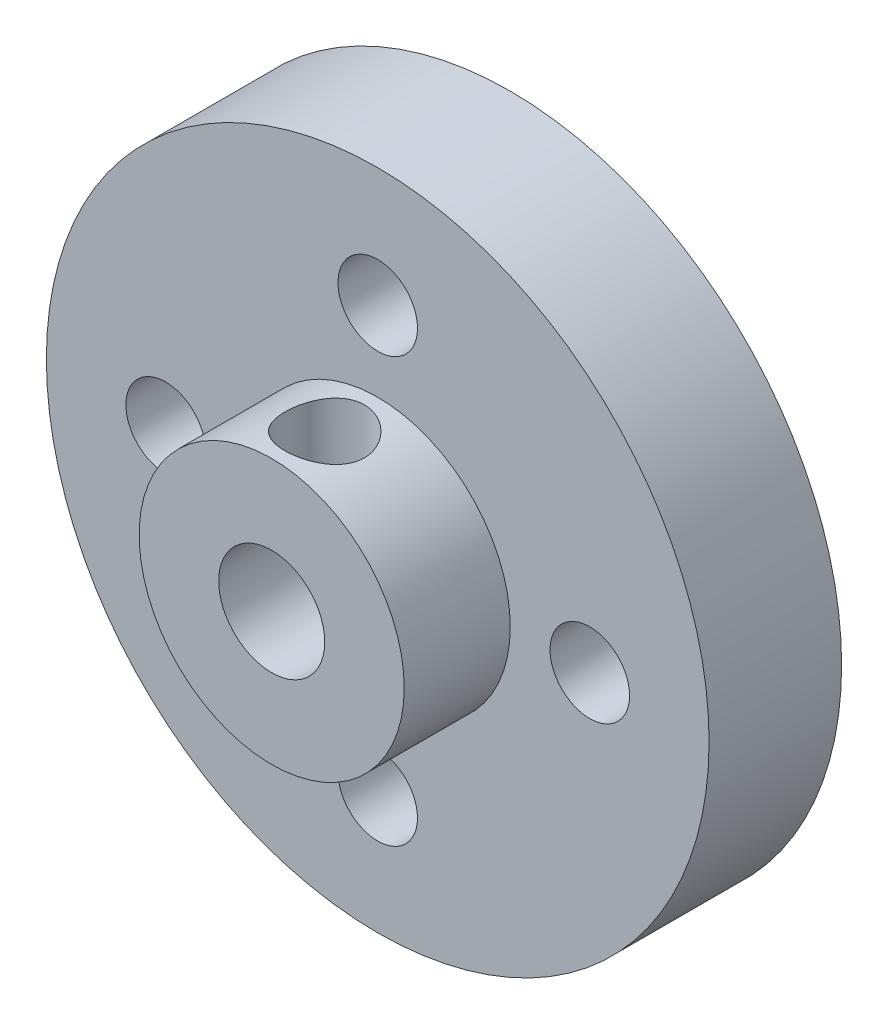
from build123d import *

# Parameters (mm, degrees)
ESQUISSE1_R             = 12.5
ESQUISSE1_R_2           = 5
ESQUISSE1_R_3           = 1.5
BOSS_EXTRU_1_DEPTH      = 5
ESQUISSE2_R             = 5
BOSS_EXTRU_2_DEPTH      = 4
ESQUISSE4_R             = 2
ENL_V_MAT_EXTRU_1_DEPTH = 20.836834425
ESQUISSE3_R             = 1.5
ENL_V_MAT_EXTRU_2_DEPTH = 20.836834425


with BuildPart() as part:
    # Esquisse1 → Boss.-Extru.1 (new body)
    with BuildSketch(Plane.XY):
        Circle(ESQUISSE1_R)
        Circle(ESQUISSE1_R_2, mode=Mode.SUBTRACT)
        with Locations((0, 8)):
            Circle(ESQUISSE1_R_3, mode=Mode.SUBTRACT)
        with Locations((8, 0)):
            Circle(ESQUISSE1_R_3, mode=Mode.SUBTRACT)
        with Locations((0, -8)):
            Circle(ESQUISSE1_R_3, mode=Mode.SUBTRACT)
        with Locations((-8, 0)):
            Circle(ESQUISSE1_R_3, mode=Mode.SUBTRACT)
    extrude(amount=BOSS_EXTRU_1_DEPTH)


with BuildPart() as body_2:
    # Esquisse2 → Boss.-Extru.2 (new body)
    with BuildSketch(Plane.XY.offset(5)):
        Circle(ESQUISSE2_R)
    extrude(amount=BOSS_EXTRU_2_DEPTH)

    # Esquisse4 → Enlèv. mat.-Extru.1 (cut, through all)
    with BuildSketch(Plane.XY.offset(9)):
        Circle(ESQUISSE4_R)
    extrude(amount=-ENL_V_MAT_EXTRU_1_DEPTH, mode=Mode.SUBTRACT)

    # Esquisse3 → Enlèv. mat.-Extru.2 (cut, through all)
    with BuildSketch(Plane(origin=(0, 0, 0), x_dir=(1, 0, 0), z_dir=(0, 1, 0))):
        with Locations(Location((0, -7, 0), (0, 0, 90))):
            Circle(ESQUISSE3_R)
    extrude(amount=ENL_V_MAT_EXTRU_2_DEPTH, mode=Mode.SUBTRACT)


solid = Compound([part.part, body_2.part])
